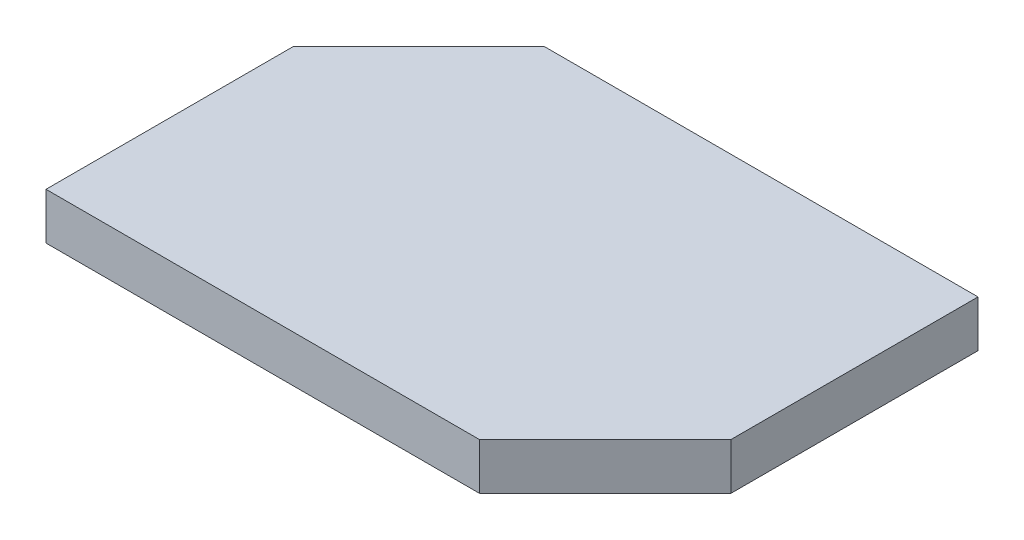
from build123d import *

# Parameters (mm, degrees)
ESBO_O1_W       = 1.2
ESBO_O1_H       = 0.8
EXTRUS_O1_DEPTH = 0.1
CHANFRO1_SIZE   = 0.27
CHANFRO2_SIZE   = 0.27


with BuildPart() as part:
    # Esboço1 → Extrusão1 (new body)
    with BuildSketch(Plane(origin=(0, 0, 0), x_dir=(1, 0, 0), z_dir=(0, 1, 0))):
        Rectangle(ESBO_O1_W, ESBO_O1_H)
    extrude(amount=EXTRUS_O1_DEPTH)

    # Chanfro1
    chanfro1_edges = [part.edges().sort_by_distance(p)[0] for p in [
        (0.6, 0.05, 0.4),
    ]]
    chamfer(chanfro1_edges, length=CHANFRO1_SIZE)

    # Chanfro2
    chanfro2_edges = [part.edges().sort_by_distance(p)[0] for p in [
        (-0.6, 0.05, -0.4),
    ]]
    chamfer(chanfro2_edges, length=CHANFRO2_SIZE)


solid = part.part
